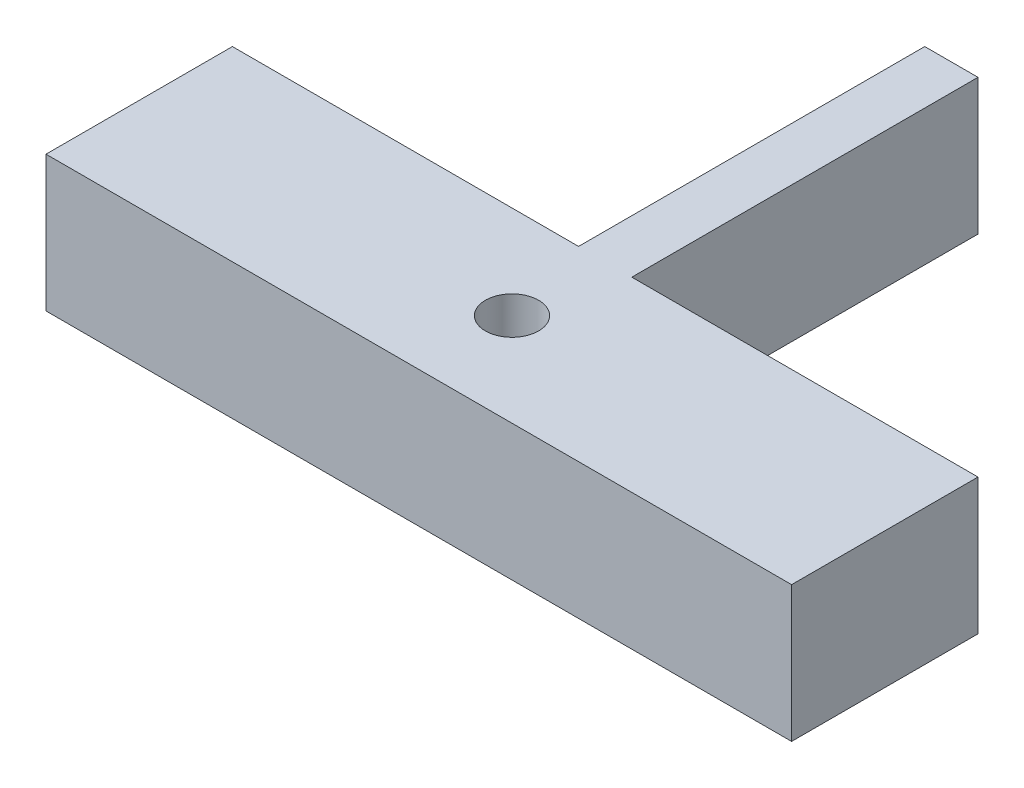
from build123d import *

# Parameters (mm, degrees)
EXTRUDE_1_DEPTH          = 25.5
CUT_EXTRUDE_1_DEPTH      = 174.925990007
CUT_EXTRUDE_1_DEPTH_BACK = 174.925990007
SKETCH_2_R               = 10


with BuildPart() as part:
    # Эскиз1 → Бобышка-Вытянуть1 (new, symmetric)
    with BuildSketch(Plane(origin=(0, 0, 0), x_dir=(1, 0, 0), z_dir=(0, 1, 0))):
        Polygon((10, 100), (-10, 100), (-10, -30), (-140, -30), (-140, -100), (140, -100), (140, -30), (10, -30), align=None)
    extrude(amount=EXTRUDE_1_DEPTH, both=True)

    # Эскиз2 → Вырез-Вытянуть1 (cut, two sides: drawn at the far end of the back side and taken through both)
    with BuildSketch(Plane(origin=(0, 0, 0), x_dir=(1, 0, 0), z_dir=(0, 1, 0)).offset(-CUT_EXTRUDE_1_DEPTH_BACK)):
        with Locations(Location((0, -65, 0), (0, 0, 270))):
            Circle(SKETCH_2_R)
    extrude(amount=CUT_EXTRUDE_1_DEPTH + CUT_EXTRUDE_1_DEPTH_BACK, mode=Mode.SUBTRACT)


solid = part.part
